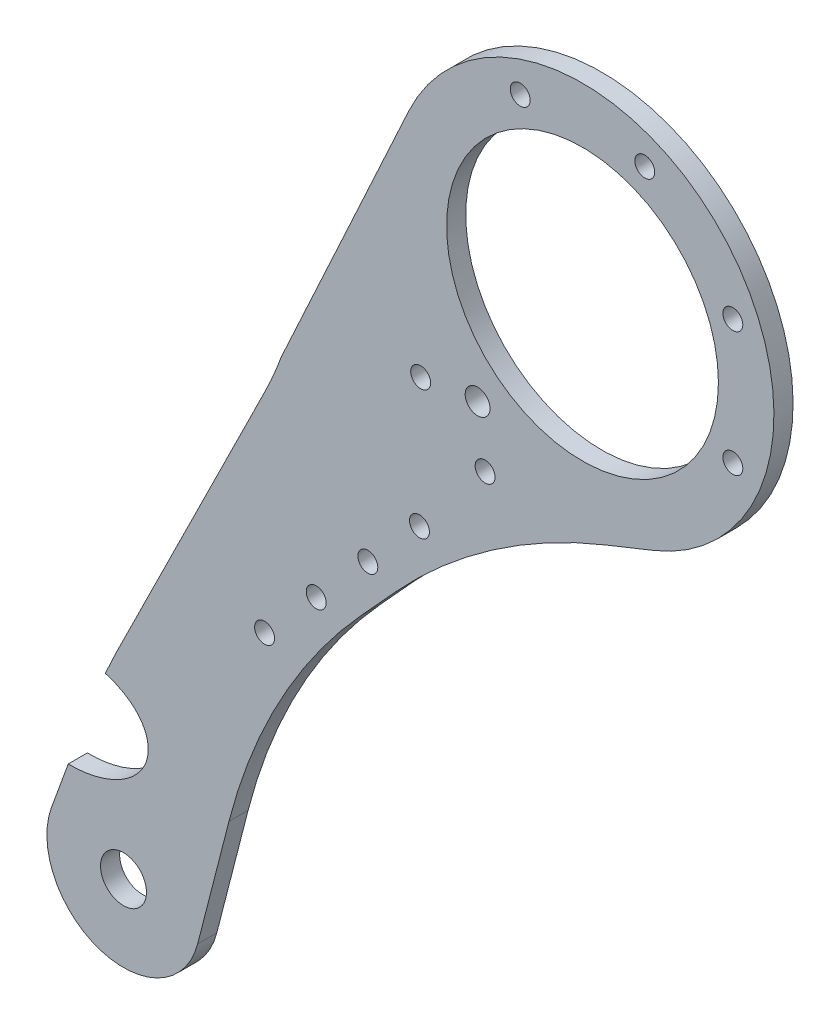
from build123d import *
from build123d.topology import SkipClean

# Parameters (mm, degrees)
SKETCH_1_R          = 6
SKETCH_1_R_2        = 2.6
SKETCH_1_R_3        = 37.5
EXTRUDE_1_DEPTH     = 5
SKETCH_3_R          = 2.6
CUT_EXTRUDE_1_DEPTH = 5
SKETCH_4_R          = 3.25
CUT_EXTRUDE_2_DEPTH = 5
CUT_EXTRUDE_START   = -10
CUT_EXTRUDE_3_DEPTH = 10
FILLET_1_R          = 150
EXTRUDE_3_DEPTH     = 5
SKETCH_10_R         = 37.5
SKETCH_10_R_2       = 35.5
EXTRUDE_4_DEPTH     = 5


with BuildPart() as part:
    # 草图1 → 凸台-拉伸1 (new body)
    with BuildSketch(Plane.XY):
        with BuildLine():
            Line((0.358293308, 100.916284199), (-32.854622217, 28.821874773))
            ThreePointArc((-32.854622217, 28.821874773), (-34.891326798, 23.674113096), (-37.20978275, 18.6469491))
            Line((-37.20978275, 18.6469491), (-75.156894594, -57.982857589))
            ThreePointArc((-75.156894594, -57.982857589), (-77.035964013, -61.883005542), (-78.830175366, -65.82291183))
            add(Edge.make_bspline(
                [(-88.535534369, -91.158809174), (-72.355308153, -91.397886609), (-68.269972706, -80.733094151), (-64.184637259, -70.068301693), (-78.830175366, -65.82291183)],
                knots=[1.469085418, 1.469085418, 1.469085418, 2.850930512, 2.850930512, 4.232775606, 4.232775606, 4.232775606], degree=2, weights=[1, 0.770658452, 1, 0.770658452, 1]))
            Line((-88.535534369, -91.158809174), (-92.901745656, -103.154876093))
            ThreePointArc((-92.901745656, -103.154876093), (-81.448806145, -128.599337595), (-55.706955028, -117.831443386))
            Line((-55.706955028, -117.831443386), (-35.528146291, -70.447418176))
            ThreePointArc((-35.528146291, -70.447418176), (-24.730140046, -48.8199667), (-11.401759845, -28.653214919))
            ThreePointArc((-11.401759845, -28.653214919), (2.584311083, -15.083976179), (17.824528317, -2.940245343))
            Line((17.824528317, -2.940245343), (75.537353513, 39.821125173))
            ThreePointArc((75.537353513, 39.821125173), (77.304389215, 118.797903942), (0.358293308, 100.916284199))
        make_face()
        with Locations((-74.10789324, -109.995278959)):
            Circle(SKETCH_1_R, mode=Mode.SUBTRACT)
        with Locations((20.334602271, 29.422705726)):
            Circle(SKETCH_1_R_2, mode=Mode.SUBTRACT)
        with Locations((3.505036467, 42.336485763)):
            Circle(SKETCH_1_R_2, mode=Mode.SUBTRACT)
        with Locations((45.770973693, 79.995278959)):
            Circle(SKETCH_1_R_3, mode=Mode.SUBTRACT)
        with Locations((-37.259309255, -35.835283977)):
            Circle(SKETCH_1_R_2, mode=Mode.SUBTRACT)
        with Locations((-10.290227117, -6.294319052)):
            Circle(SKETCH_1_R_2, mode=Mode.SUBTRACT)
        with Locations((-23.774768186, -21.064801514)):
            Circle(SKETCH_1_R_2, mode=Mode.SUBTRACT)
        with Locations((3.194313951, 8.47616341)):
            Circle(SKETCH_1_R_2, mode=Mode.SUBTRACT)
        with BuildLine():
            Line((-22.21556637, 27.604392026), (-54.704409436, -38.003071698))
            ThreePointArc((-54.704409436, -38.003071698), (-54.041179731, -40.541440848), (-51.435079158, -40.239064605))
            Line((-51.435079158, -40.239064605), (-2.344616972, 13.53286631))
            ThreePointArc((-2.344616972, 13.53286631), (-1.063104932, 17.411942839), (-3.102225927, 20.951927782))
            Line((-3.102225927, 20.951927782), (-14.799849632, 29.433471229))
            ThreePointArc((-14.799849632, 29.433471229), (-18.932222858, 30.240060993), (-22.21556637, 27.604392026))
        make_face(mode=Mode.SUBTRACT)
    extrude(amount=EXTRUDE_1_DEPTH)

    # 草图3 → 切除-拉伸1 (cut)
    with BuildSketch(Plane.XY.offset(5)):
        with Locations((62.035019569, 119.260159091)):
            Circle(SKETCH_3_R)
        with Locations((85.035853825, 96.259324835)):
            Circle(SKETCH_3_R)
        with Locations((85.035853825, 63.731233084)):
            Circle(SKETCH_3_R)
        with Locations((29.506927818, 119.260159091)):
            Circle(SKETCH_3_R)
    extrude(amount=-CUT_EXTRUDE_1_DEPTH, mode=Mode.SUBTRACT)

    # 草图4 → 切除-拉伸2 (cut)
    with BuildSketch(Plane.XY.offset(5)):
        with Locations((18.376709388, 44.294378646)):
            Circle(SKETCH_4_R)
    extrude(amount=-CUT_EXTRUDE_2_DEPTH, mode=Mode.SUBTRACT)

    # 草图5 → 切除-拉伸3 (cut)
    with SkipClean():  # the faces are left unmerged after this step: merging them gives an invalid solid
        with BuildSketch(Plane.XY.offset(5).offset(CUT_EXTRUDE_START)):
            with BuildLine():
                Line((20.049990287, 15.81541739), (-37.259309255, -46.959133074))
                Line((-37.259309255, -46.959133074), (-54.737255051, -114.973067238))
                ThreePointArc((-54.737255051, -114.973067238), (-55.168105108, -116.420574711), (-55.706955028, -117.831443386))
                Line((-55.706955028, -117.831443386), (-35.528146291, -70.447418176))
                ThreePointArc((-35.528146291, -70.447418176), (-24.730140046, -48.8199667), (-11.401759845, -28.653214919))
                ThreePointArc((-11.401759845, -28.653214919), (2.584311083, -15.083976179), (17.824528317, -2.940245343))
                Line((17.824528317, -2.940245343), (75.537353513, 39.821125173))
                ThreePointArc((75.537353513, 39.821125173), (70.157014525, 36.345295998), (64.376457336, 33.585840497))
                Line((64.376457336, 33.585840497), (20.049990287, 15.81541739))
            make_face()
        extrude(amount=CUT_EXTRUDE_3_DEPTH, mode=Mode.SUBTRACT)

    # 圆角1
    fillet_1_edges = [part.edges().sort_by_distance(p)[0] for p in [
        (-37.259309255, -46.959133074, 2.5),
        (20.049990287, 15.81541739, 2.5),
    ]]
    fillet(fillet_1_edges, radius=FILLET_1_R)

    # 草图9 → 凸台-拉伸3 (add, through all)
    with SkipClean():  # the faces are left unmerged after this step: merging them gives an invalid solid
        with BuildSketch(Plane.XY.offset(5)):
            with BuildLine():
                Line((-51.435079158, -40.239064605), (-2.344616972, 13.53286631))
                ThreePointArc((-2.344616972, 13.53286631), (-1.063104932, 17.411942839), (-3.102225927, 20.951927782))
                Line((-3.102225927, 20.951927782), (-14.799849632, 29.433471229))
                ThreePointArc((-14.799849632, 29.433471229), (-18.932222858, 30.240060993), (-22.21556637, 27.604392026))
                Line((-22.21556637, 27.604392026), (-54.704409436, -38.003071698))
                ThreePointArc((-54.704409436, -38.003071698), (-54.041179731, -40.541440848), (-51.435079158, -40.239064605))
            make_face()
        extrude(amount=-EXTRUDE_3_DEPTH)

    # 草图10 → 凸台-拉伸4 (add, through all)
    with SkipClean():  # the faces are left unmerged after this step: merging them gives an invalid solid
        with BuildSketch(Plane.XY.offset(5)):
            with Locations((45.770973693, 79.995278959)):
                Circle(SKETCH_10_R)
            with Locations((45.770973693, 79.995278959)):
                Circle(SKETCH_10_R_2, mode=Mode.SUBTRACT)
        extrude(amount=-EXTRUDE_4_DEPTH)


solid = part.part
